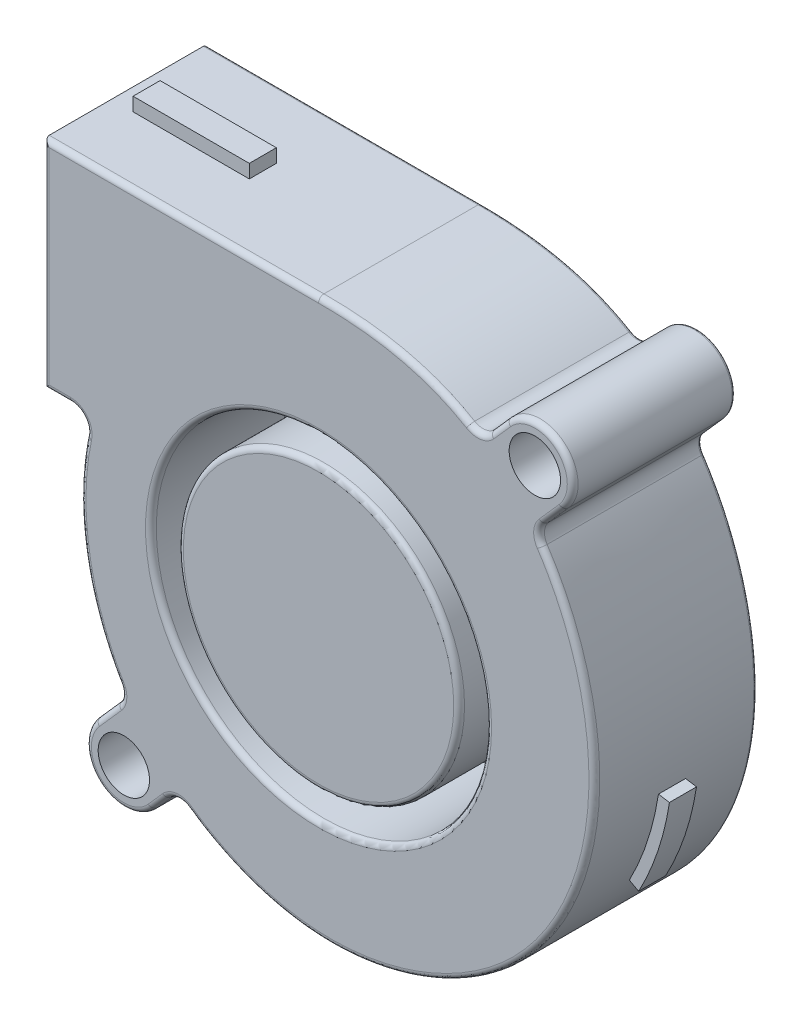
from build123d import *

# Parameters (mm, degrees)
SKETCH1_R           = 2.375
BOSS_EXTRUDE1_DEPTH = 15
FILLET1_R           = 1.5
SKETCH2_R           = 15.5
SKETCH2_R_2         = 13
CUT_EXTRUDE1_DEPTH  = 12
FILLET2_R           = 0.5
SKETCH5_W           = 12.7
SKETCH5_H           = 17.7
CUT_EXTRUDE2_DEPTH  = 8
FILLET3_R           = 0.5
FILLET4_R           = 0.25
SKETCH6_W           = 10.75
SKETCH6_H           = 1.25
BOSS_EXTRUDE2_DEPTH = 1.25
BOSS_EXTRUDE3_DEPTH = 1.25
SKETCH8_W           = 5
SKETCH8_H           = 25
CUT_EXTRUDE3_DEPTH  = 2


with BuildPart() as part:
    # Sketch1 → Boss-Extrude1 (new body)
    # profile 1 of 2: a face of its own
    with BuildSketch(Plane.XY):
        with BuildLine():
            Line((0, 26.5), (-25.4, 26.5))
            Line((-25.4, 26.5), (-25.4, 6.5))
            Line((-25.4, 6.5), (-21, 6.5))
            add(Edge.make_bspline(
                [(-21, 6.5), (-23.409444845, -1.418121323), (-20.045581622, -17.761146267), (0.764261584, -27.66885822), (20.530686096, -19.585337286), (28.156792832, 0.871491638), (20.059016314, 22.251916338), (7.77112253, 26.537335278), (0, 26.5)],
                knots=[0, 0, 0, 0, 0.205943934, 0.348493256, 0.51377949, 0.666949624, 0.846263104, 1, 1, 1, 1], degree=3))
        make_face()
    # profile 2 of 2: a face of its own
    with BuildSketch(Plane.XY):
        with BuildLine():
            Line((-20.622651799, -17.682307712), (17.377348201, 25.317692288))
            ThreePointArc((17.377348201, 25.317692288), (22.317692288, 25.622651799), (22.622651799, 20.682307712))
            Line((22.622651799, 20.682307712), (-15.377348201, -22.317692288))
            ThreePointArc((-15.377348201, -22.317692288), (-20.317692288, -22.622651799), (-20.622651799, -17.682307712))
        make_face()
        with Locations((20, 23)):
            Circle(SKETCH1_R, mode=Mode.SUBTRACT)
        with Locations((-18, -20)):
            Circle(SKETCH1_R, mode=Mode.SUBTRACT)
    extrude(amount=BOSS_EXTRUDE1_DEPTH)

    # Fillet1
    fillet1_edges = [part.edges().sort_by_distance(p)[0] for p in [
        (-21, 6.5, 7.5),
        (-17.860606655, -14.556835576, 7.5),
        (14.981594875, 22.606708261, 7.5),
        (19.982871598, 17.695188011, 7.5),
        (-13.121586655, -19.765120012, 7.5),
    ]]
    fillet(fillet1_edges, radius=FILLET1_R)

    # Sketch2 → Cut-Extrude1 (cut)
    with BuildSketch(Plane.XY.offset(15)):
        Circle(SKETCH2_R)
        Circle(SKETCH2_R_2, mode=Mode.SUBTRACT)
    extrude(amount=-CUT_EXTRUDE1_DEPTH, mode=Mode.SUBTRACT)

    # Fillet2
    fillet2_edges = [part.edges().sort_by_distance(p)[0] for p in [
        (-15.5, 0, 15),
        (-13, 0, 15),
    ]]
    fillet(fillet2_edges, radius=FILLET2_R)

    # Sketch5 → Cut-Extrude2 (cut)
    with BuildSketch(Plane.ZY.offset(25.4)):
        with Locations((7.5, 16.5)):
            Rectangle(SKETCH5_W, SKETCH5_H)
    extrude(amount=-CUT_EXTRUDE2_DEPTH, mode=Mode.SUBTRACT)

    # Fillet3
    fillet3_edges = [part.edges().sort_by_distance(p)[0] for p in [
        (-12.7, 26.5, 15),
        (-25.4, 16.5, 15),
        (-24.168039599, 6.5, 15),
        (-19.611864332, -16.538521895, 15),
        (-20.317692288, -22.622651799, 15),
        (7.200064138, 25.836744368, 15),
        (-14.707964441, -21.560231717, 15),
        (16.604590147, 24.443255542, 15),
        (21.693815427, 19.631256028, 15),
        (-12.5, 0, 15),
        (-21.644364047, -4.755167108, 15),
        (14.939113738, 23.08005215, 15),
        (20.392438687, 17.688819375, 15),
        (-18.231746817, -14.54280556, 15),
        (-13.088095211, -20.306136662, 15),
        (22.317692288, 25.622651799, 15),
        (-21.769328232, 5.942704716, 15),
    ]]
    fillet(fillet3_edges, radius=FILLET3_R)

    # Fillet4
    fillet4_edges = [part.edges().sort_by_distance(p)[0] for p in [
        (22.317692288, 25.622651799, 0),
        (-14.707964441, -21.560231717, 0),
        (-20.317692288, -22.622651799, 0),
        (-19.611864332, -16.538521895, 0),
        (-24.168039599, 6.5, 0),
        (-25.4, 16.5, 0),
        (-12.7, 26.5, 0),
        (16.604590147, 24.443255542, 0),
        (21.693815427, 19.631256028, 0),
    ]]
    fillet(fillet4_edges, radius=FILLET4_R)

    # Sketch6 → Boss-Extrude2 (add, symmetric)
    with BuildSketch(Plane.XY.offset(7.5)):
        with Locations((-18.025, 27.125)):
            Rectangle(SKETCH6_W, SKETCH6_H)
        with BuildLine():
            Line((-22.649503306, 4), (-19.89329876, 4))
            Line((-19.89329876, 4), (-19.89329876, -4.997798156))
            Line((-19.89329876, -4.997798156), (-22.450434597, -4.997798156))
            ThreePointArc((-22.450434597, -4.997798156), (-22.994373064, -0.508731145), (-22.649503306, 4))
        make_face()
    extrude(amount=BOSS_EXTRUDE2_DEPTH, both=True)

    # Sketch7 → Boss-Extrude3 (add, symmetric)
    with BuildSketch(Plane.XY.offset(7.5)):
        with BuildLine():
            Line((26.196373795, -4), (23.346821914, -3.564893691))
            Line((23.346821914, -3.564893691), (19.607244504, -10.528870422))
            Line((19.607244504, -10.528870422), (23.346821914, -12.536981555))
            ThreePointArc((23.346821914, -12.536981555), (25.136667913, -8.390347205), (26.196373795, -4))
        make_face()
    extrude(amount=BOSS_EXTRUDE3_DEPTH, both=True)

    # Sketch8 → Cut-Extrude3 (cut)
    with BuildSketch(Plane(origin=(0, 0, 0), x_dir=(-1, 0, 0), z_dir=(0, 0, -1))):
        with Locations((0, -17.5)):
            Rectangle(SKETCH8_W, SKETCH8_H)
    extrude(amount=-CUT_EXTRUDE3_DEPTH, mode=Mode.SUBTRACT)


solid = part.part
